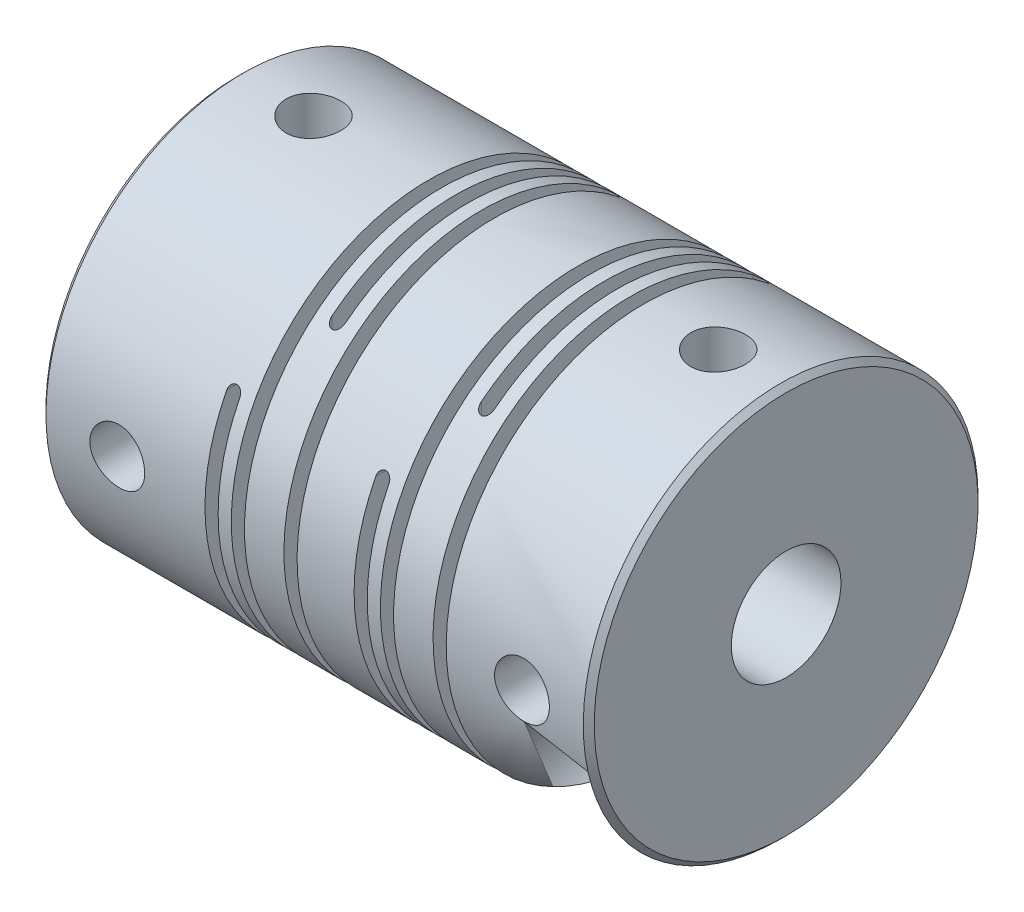
from build123d import *

# Parameters (mm, degrees)
CUT_EXTRUDE_1_DEPTH         = 10.5
CUT_EXTRUDE_1_DEPTH_BACK    = 10.5
CUT_EXTRUDE_2_DEPTH         = 10.5
CUT_EXTRUDE_2_DEPTH_BACK    = 10.5
CUT_EXTRUDE_3_DEPTH         = 10.5
CUT_EXTRUDE_3_DEPTH_BACK    = 10.5
CUT_EXTRUDE_4_DEPTH         = 10.5
CUT_EXTRUDE_4_DEPTH_BACK    = 10.5
HOLE_WIZARD_M3_1_AT_2_COUNT = 2
HOLE_WIZARD_M3_1_AT_2_PITCH = 18.453350141
PATTERN_CIRCULAR_1_COUNT    = 2
PATTERN_CIRCULAR_1_ANGLE    = 90


with BuildPart() as part:
    # 草图1 → 旋转1 (revolve)
    with BuildSketch(Plane.XY):
        Polygon((0, 10.25), (0, 4), (6.5, 4), (6.5, 4.25), (17.5, 4.25), (17.5, 4), (25, 4), (25, 10.25), (24.75, 10.5), (0.25, 10.5), align=None)
    revolve(axis=Axis((25, 1.5, 0), (-1, 0, 0)))

    # 草图4 → 切除-拉伸1 (cut, two sides: drawn at the far end of the back side and taken through both)
    with BuildSketch(Plane.XY.offset(-CUT_EXTRUDE_1_DEPTH_BACK)):
        with BuildLine():
            Line((7.5, -11.5), (14.9, -11.5))
            Line((14.9, -11.5), (14.9, 5.6))
            ThreePointArc((14.9, 5.6), (14.6, 5.9), (14.3, 5.6))
            Line((14.3, 5.6), (14.3, -10.25))
            Line((14.3, -10.25), (8.1, -10.25))
            Line((8.1, -10.25), (8.1, 5.6))
            ThreePointArc((8.1, 5.6), (7.8, 5.9), (7.5, 5.6))
            Line((7.5, 5.6), (7.5, -11.5))
        make_face()
    extrude(amount=CUT_EXTRUDE_1_DEPTH + CUT_EXTRUDE_1_DEPTH_BACK, mode=Mode.SUBTRACT)

    # 草图5 → 切除-拉伸2 (cut, two sides: drawn at the far end of the back side and taken through both)
    with BuildSketch(Plane.XY.offset(-CUT_EXTRUDE_2_DEPTH_BACK)):
        with BuildLine():
            Line((8.7, 11.5), (8.7, -5.6))
            ThreePointArc((8.7, -5.6), (9, -5.9), (9.3, -5.6))
            Line((9.3, -5.6), (9.3, 10.647030622))
            Line((9.3, 10.647030622), (15.5, 10.647030622))
            Line((15.5, 10.647030622), (15.5, -5.6))
            ThreePointArc((15.5, -5.6), (15.8, -5.9), (16.1, -5.6))
            Line((16.1, -5.6), (16.1, 11.5))
            Line((16.1, 11.5), (8.7, 11.5))
        make_face()
    extrude(amount=CUT_EXTRUDE_2_DEPTH + CUT_EXTRUDE_2_DEPTH_BACK, mode=Mode.SUBTRACT)

    # 草图6 → 切除-拉伸3 (cut, two sides: drawn at the far end of the back side and taken through both)
    with BuildSketch(Plane(origin=(0, 0, 0), x_dir=(1, 0, 0), z_dir=(0, 1, 0)).offset(-CUT_EXTRUDE_3_DEPTH_BACK)):
        with BuildLine():
            Line((11.1, -11.5), (18.5, -11.5))
            Line((18.5, -11.5), (18.5, 5.6))
            ThreePointArc((18.5, 5.6), (18.2, 5.9), (17.9, 5.6))
            Line((17.9, 5.6), (17.9, -10.25))
            Line((17.9, -10.25), (11.7, -10.25))
            Line((11.7, -10.25), (11.7, 5.6))
            ThreePointArc((11.7, 5.6), (11.4, 5.9), (11.1, 5.6))
            Line((11.1, 5.6), (11.1, -11.5))
        make_face()
    extrude(amount=CUT_EXTRUDE_3_DEPTH + CUT_EXTRUDE_3_DEPTH_BACK, mode=Mode.SUBTRACT)

    # 草图7 → 切除-拉伸4 (cut, two sides: drawn at the far end of the back side and taken through both)
    with BuildSketch(Plane(origin=(0, 0, 0), x_dir=(1, 0, 0), z_dir=(0, 1, 0)).offset(-CUT_EXTRUDE_4_DEPTH_BACK)):
        with BuildLine():
            Line((9.9, 11.5), (9.9, -5.6))
            ThreePointArc((9.9, -5.6), (10.2, -5.9), (10.5, -5.6))
            Line((10.5, -5.6), (10.5, 10.25))
            Line((10.5, 10.25), (16.7, 10.25))
            Line((16.7, 10.25), (16.7, -5.6))
            ThreePointArc((16.7, -5.6), (17, -5.9), (17.3, -5.6))
            Line((17.3, -5.6), (17.3, 11.5))
            Line((17.3, 11.5), (9.9, 11.5))
        make_face()
    extrude(amount=CUT_EXTRUDE_4_DEPTH + CUT_EXTRUDE_4_DEPTH_BACK, mode=Mode.SUBTRACT)

    # 草图9 → M3 螺纹孔1 (revolve, cut)
    with BuildSketch(Plane(origin=(3.50092792, 1.447476233, 8.999846735), x_dir=(0, -0.9999829705580834, -0.005835974111611874), z_dir=(1, 0, 0))):
        Polygon((0, 0), (0, 8.251075774), (1.25, 7.5), (1.25, 0), align=None)
    hole_wizard_m3_1 = revolve(axis=Axis((3.50092792, 1.410417797, 15.349738598), (0, 0.005835974111611876, -0.9999829705580833)), mode=Mode.SUBTRACT)

    # M3 螺纹孔1 at 2: M3 螺纹孔1 ×2
    with Locations(*[(i * HOLE_WIZARD_M3_1_AT_2_PITCH, 0, 0) for i in range(1, HOLE_WIZARD_M3_1_AT_2_COUNT)]):
        add(hole_wizard_m3_1, mode=Mode.SUBTRACT)

    # 阵列(圆周)1: M3 螺纹孔1 ×2 about axis
    pattern_circular_1_axis = Axis((6.5, 1.5, 0), (-1, 0, 0))
    for i in range(1, PATTERN_CIRCULAR_1_COUNT):
        add(hole_wizard_m3_1.rotate(pattern_circular_1_axis, i * PATTERN_CIRCULAR_1_ANGLE / (PATTERN_CIRCULAR_1_COUNT - 1)), mode=Mode.SUBTRACT)

    # 阵列(圆周)1 copy 1 sketch → 阵列(圆周)1 copy 1 (revolve, cut)
    with BuildSketch(Plane(origin=(21.954278061, 10.499846735, 0.052523767), x_dir=(0, -0.005835974111608383, 0.9999829705580834), z_dir=(1, 0, 0))):
        Polygon((0, 0), (0, 8.251075774), (1.25, 7.5), (1.25, 0), align=None)
    revolve(axis=Axis((21.954278061, 16.849738598, 0.089582203), (0, -0.9999829705580833, -0.005835974111608385)), mode=Mode.SUBTRACT)


solid = part.part
